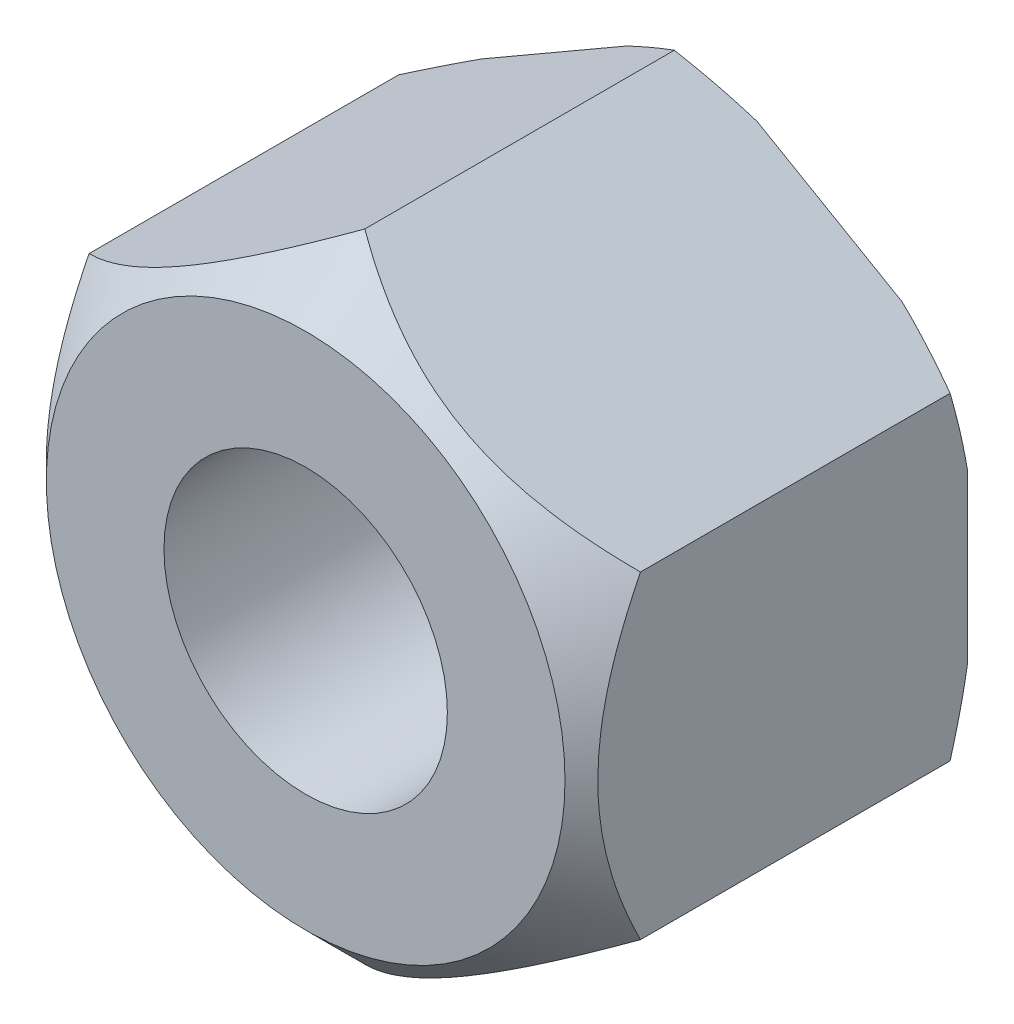
from build123d import *

# Parameters (mm, degrees)
SKETCH_1_R          = 2.45875
EXTRUDE_555_DEPTH   = 6.7
SKETCH_2_OUTSIDE_W  = 52.598
SKETCH_2_OUTSIDE_H  = 54.078
SKETCH_2_OUTSIDE_R  = 5
CUT_EXTRUDE_1_DEPTH = 10.915132059
CUT_EXTRUDE_1_DRAFT = -60
CHAMFER_1_SIZE      = 0.129464286
SKETCH_9_OUTSIDE_W  = 36.616
SKETCH_9_OUTSIDE_H  = 38.096
SKETCH_9_OUTSIDE_R  = 4.5
CUT_EXTRUDE_7_DEPTH = 10.915132059
CUT_EXTRUDE_7_DRAFT = -45


with BuildPart() as part:
    # 草图1 → Extrude 555 (new body)
    with BuildSketch(Plane.XY):
        Polygon((0, 5.525), (-4.784790356, 2.7625), (-4.784790356, -2.7625), (0, -5.525), (4.784790356, -2.7625), (4.784790356, 2.7625), align=None)
        Circle(SKETCH_1_R, mode=Mode.SUBTRACT)
    extrude(amount=EXTRUDE_555_DEPTH)


with BuildPart() as cut_extrude_1_tool:
    # 草图2 outside → 切除-拉伸1 (with draft: the straight prism first)
    with BuildSketch(Plane(origin=(0, 0, 0), x_dir=(-1, 0, 0), z_dir=(0, 0, -1))):
        Rectangle(SKETCH_2_OUTSIDE_W, SKETCH_2_OUTSIDE_H)
        Circle(SKETCH_2_OUTSIDE_R, mode=Mode.SUBTRACT)
    extrude(amount=-CUT_EXTRUDE_1_DEPTH)
    # 切除-拉伸1: the draft: its side faces are tilted about the plane it starts from
    cut_extrude_1_sides = [cut_extrude_1_tool.faces().sort_by_distance(p)[0] for p in [
        (0, -27.039, 5.45756603),
        (-26.299, 0, 5.45756603),
        (0, 27.039, 5.45756603),
        (26.299, 0, 5.45756603),
        (5, 0, 5.45756603),
    ]]
    draft(cut_extrude_1_sides, Plane(origin=(0, 0, 0), x_dir=(-1, 0, 0), z_dir=(0, 0, -1)), CUT_EXTRUDE_1_DRAFT)


with BuildPart() as part_1:
    add(part.part)

    # 切除-拉伸1: cut by cut_extrude_1_tool
    add(cut_extrude_1_tool.part, mode=Mode.SUBTRACT)

    # 倒角1
    chamfer_1_edges = [part_1.edges().sort_by_distance(p)[0] for p in [
        (-2.45875, 0, 0),
    ]]
    chamfer(chamfer_1_edges, length=CHAMFER_1_SIZE)


with BuildPart() as cut_extrude_7_tool:
    # 草图9 outside → 切除-拉伸7 (with draft: the straight prism first)
    with BuildSketch(Plane.XY.offset(6.7)):
        Rectangle(SKETCH_9_OUTSIDE_W, SKETCH_9_OUTSIDE_H)
        Circle(SKETCH_9_OUTSIDE_R, mode=Mode.SUBTRACT)
    extrude(amount=-CUT_EXTRUDE_7_DEPTH)
    # 切除-拉伸7: the draft: its side faces are tilted about the plane it starts from
    cut_extrude_7_sides = [cut_extrude_7_tool.faces().sort_by_distance(p)[0] for p in [
        (0, -19.048, 1.24243397),
        (18.308, 0, 1.24243397),
        (0, 19.048, 1.24243397),
        (-18.308, 0, 1.24243397),
        (-4.5, 0, 1.24243397),
    ]]
    draft(cut_extrude_7_sides, Plane.XY.offset(6.7), CUT_EXTRUDE_7_DRAFT)


with BuildPart() as part_2:
    add(part_1.part)

    # 切除-拉伸7: cut by cut_extrude_7_tool
    add(cut_extrude_7_tool.part, mode=Mode.SUBTRACT)


solid = part_2.part
